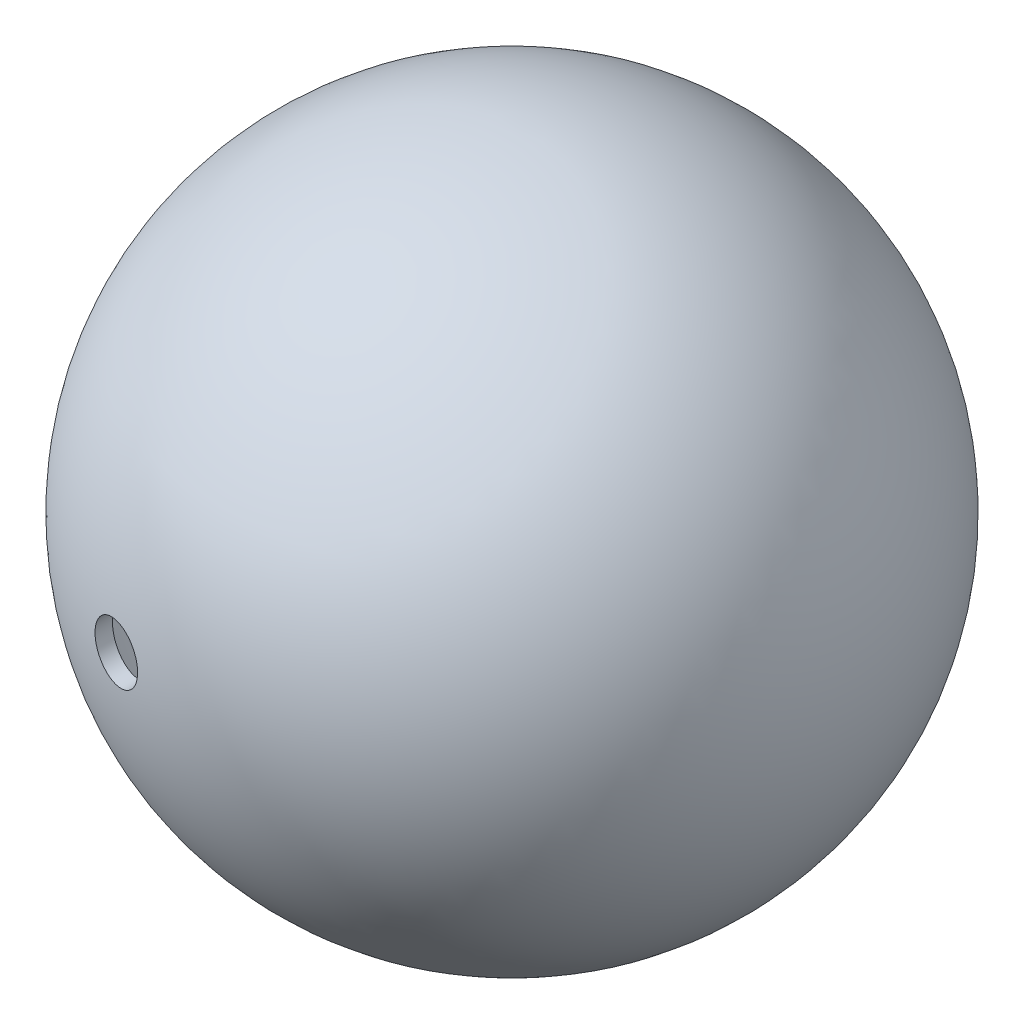
from build123d import *

# Parameters (mm, degrees)
SKETCH2_R          = 1.1
CUT_EXTRUDE1_DEPTH = 50


with BuildPart() as part:
    # Sketch1 → Revolve1 (revolve)
    with BuildSketch(Plane.XY):
        with BuildLine():
            ThreePointArc((0, -12.98), (12.98, 0), (0, 12.98))
            Line((0, 12.98), (0, 12.33))
            ThreePointArc((0, 12.33), (12.33, 0), (0, -12.33))
            Line((0, -12.33), (0, -12.98))
        make_face()
    revolve(axis=Axis((0, 13.698850575, 0), (0, -1, 0)))

    # Sketch2 → Cut-Extrude1 (cut)
    with BuildSketch(Plane.XY):
        with Locations((-3, 0)):
            Circle(SKETCH2_R)
    extrude(amount=CUT_EXTRUDE1_DEPTH, mode=Mode.SUBTRACT)

    # Sketch3 → Cut-Revolve3 (revolve, cut)
    with BuildSketch(Plane(origin=(0, 0, 0), x_dir=(1, 0, 0), z_dir=(0, 1, 0))):
        with BuildLine():
            Line((2.977717522, 11.965036496), (3.576963888, 12.477408759))
            ThreePointArc((3.576963888, 12.477408759), (2.478777586, 14.913033426), (0, 15.91))
            Line((0, 15.91), (0, 12.33))
            ThreePointArc((0, 12.33), (1.5, 12.238419016), (2.977717522, 11.965036496))
        make_face()
    revolve(axis=Axis((0, 0, -16.529593551), (0, 0, 1)), mode=Mode.SUBTRACT)


solid = part.part
